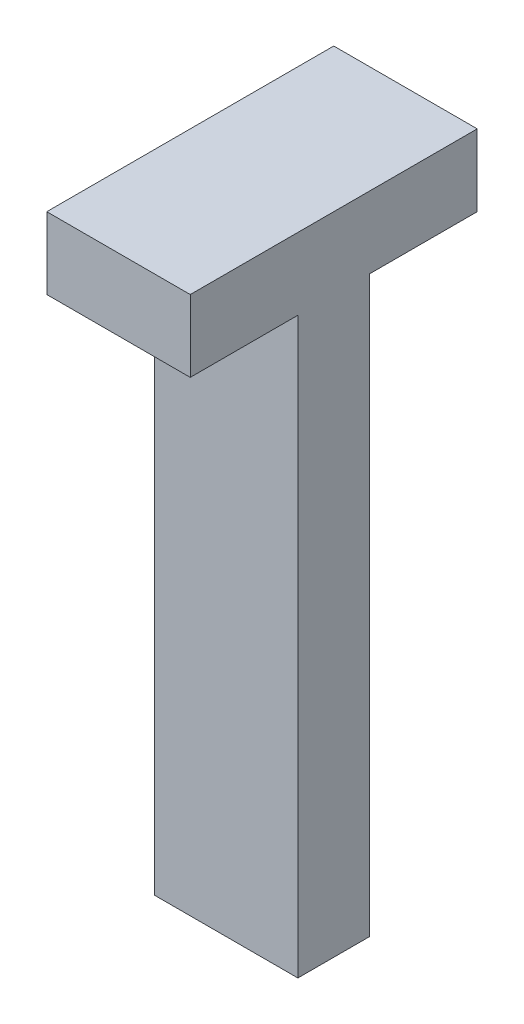
from build123d import *

# Parameters (mm, degrees)
BOSS_EXTRUDE1_DEPTH = 20


with BuildPart() as part:
    # Sketch2 → Boss-Extrude1 (new body)
    with BuildSketch(Plane.YZ):
        Polygon((0, 0), (0, 40), (-10, 40), (-10, 25), (-90, 25), (-90, 15), (-10, 15), (-10, 0), align=None)
    extrude(amount=BOSS_EXTRUDE1_DEPTH)


solid = part.part
